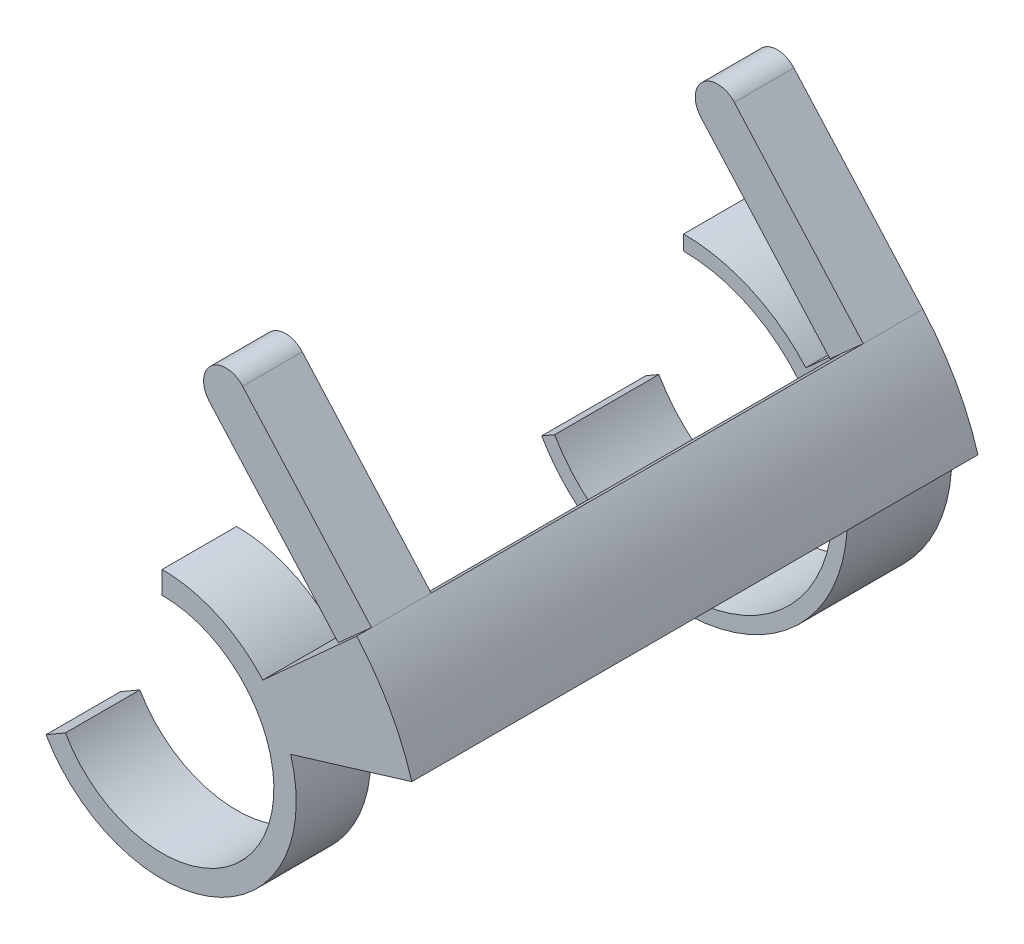
from build123d import *

# Parameters (mm, degrees)
BOSS_EXTRUDE1_DEPTH = 7
BOSS_EXTRUDE2_START = -3
BOSS_EXTRUDE2_DEPTH = 3
BOSS_EXTRUDE3_DEPTH = 30
BOSS_EXTRUDE4_DEPTH = 5
BOSS_EXTRUDE5_DEPTH = 5
BOSS_EXTRUDE6_DEPTH = 4
BOSS_EXTRUDE7_DEPTH = 4


with BuildPart() as part:
    # Sketch1 → Boss-Extrude1 (new body)
    with BuildSketch(Plane.XY):
        with BuildLine():
            Line((-9.526279442, -5.5), (-8.660254038, -5))
            ThreePointArc((-8.660254038, -5), (8.660254038, -5), (0, 10))
            Line((0, 10), (0, 11))
            ThreePointArc((0, 11), (9.526279442, -5.5), (-9.526279442, -5.5))
        make_face()
    extrude(amount=BOSS_EXTRUDE1_DEPTH)

    # Sketch3 → Boss-Extrude2 (add)
    with BuildSketch(Plane.XY.offset(7).offset(BOSS_EXTRUDE2_START)):
        with BuildLine():
            Line((8.207415224, 7.323819723), (13.057251493, 11.651531377))
            ThreePointArc((13.057251493, 11.651531377), (15.26959545, 8.549237088), (16.758038643, 5.041640689))
            Line((16.758038643, 5.041640689), (10.53362429, 3.16903129))
            ThreePointArc((10.53362429, 3.16903129), (9.598031426, 5.37380617), (8.207415224, 7.323819723))
        make_face()
    extrude(amount=BOSS_EXTRUDE2_DEPTH)

    # Sketch4 → Boss-Extrude3 (add)
    with BuildSketch(Plane.XY.offset(7)):
        with BuildLine():
            Line((13.057251493, 11.651531377), (11.56499418, 10.319927791))
            ThreePointArc((11.56499418, 10.319927791), (13.524498827, 7.572181421), (14.842834227, 4.465453182))
            Line((14.842834227, 4.465453182), (16.758038643, 5.041640689))
            ThreePointArc((16.758038643, 5.041640689), (15.26959545, 8.549237088), (13.057251493, 11.651531377))
        make_face()
    extrude(amount=BOSS_EXTRUDE3_DEPTH)



with BuildPart() as body_2:
    # Sketch5 → Boss-Extrude4 (new body)
    with BuildSketch(Plane.XY.offset(37)):
        with BuildLine():
            Line((0, 9), (0, 7.5))
            ThreePointArc((0, 7.5), (6.495190528, -3.75), (-6.495190528, -3.75))
            Line((-6.495190528, -3.75), (-7.794228634, -4.5))
            ThreePointArc((-7.794228634, -4.5), (7.794228634, -4.5), (0, 9))
        make_face()
    extrude(amount=BOSS_EXTRUDE4_DEPTH)


with BuildPart() as part_1:
    add(part.part)

    add(body_2.part)  # Boss-Extrude5 merges body 2
    # Sketch6 → Boss-Extrude5 (add)
    with BuildSketch(Plane.XY.offset(37)):
        with BuildLine():
            Line((6.756344772, 5.945738417), (13.057251493, 11.651531377))
            ThreePointArc((13.057251493, 11.651531377), (15.26959545, 8.549237088), (16.758038643, 5.041640689))
            Line((16.758038643, 5.041640689), (8.626140517, 2.567041054))
            ThreePointArc((8.626140517, 2.567041054), (7.87458649, 4.357853556), (6.756344772, 5.945738417))
        make_face()
    extrude(amount=BOSS_EXTRUDE5_DEPTH)

    # Sketch7 → Boss-Extrude6 (add)
    with BuildSketch(Plane(origin=(0, 0, 4), x_dir=(-1, 0, 0), z_dir=(0, 0, -1))):
        with BuildLine():
            Line((-10.818865523, 9.654125998), (-13.057251493, 11.651531377))
            Line((-13.057251493, 11.651531377), (-4.401828185, 21.351203915))
            ThreePointArc((-4.401828185, 21.351203915), (-2.28393251, 21.471694211), (-2.163442214, 19.353798536))
            Line((-2.163442214, 19.353798536), (-10.818865523, 9.654125998))
        make_face()
    extrude(amount=-BOSS_EXTRUDE6_DEPTH)


with BuildPart() as body_2_2:
    # Sketch8 → Boss-Extrude7 (new body)
    with BuildSketch(Plane(origin=(0, 0, 37), x_dir=(-1, 0, 0), z_dir=(0, 0, -1))):
        with BuildLine():
            Line((-10.818865523, 9.654125998), (-13.057251493, 11.651531377))
            Line((-13.057251493, 11.651531377), (-4.401828185, 21.351203915))
            ThreePointArc((-4.401828185, 21.351203915), (-2.28393251, 21.471694211), (-2.163442214, 19.353798536))
            Line((-2.163442214, 19.353798536), (-10.818865523, 9.654125998))
        make_face()
    extrude(amount=-BOSS_EXTRUDE7_DEPTH)


solid = Compound([part_1.part, body_2_2.part])
